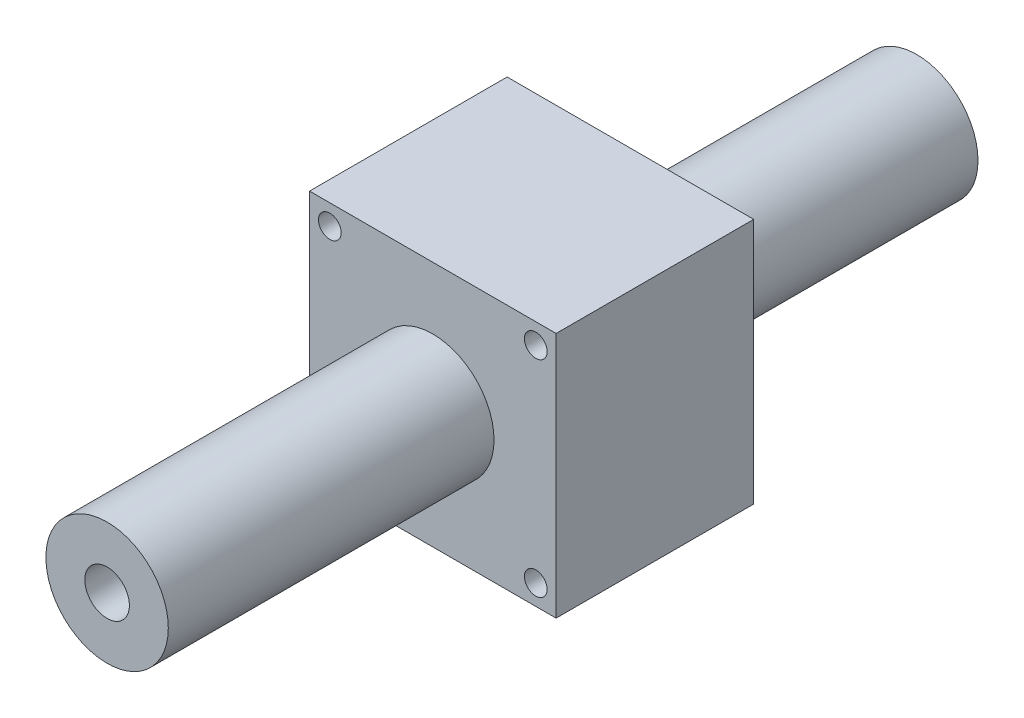
from build123d import *

# Parameters (mm, degrees)
NA23_MOTOR_ENVELOPE_START         = -45.2
SKETCH1_W                         = 56.4
SKETCH1_H                         = 56.4
SKETCH1_R                         = 2.6
NA23_MOTOR_ENVELOPE_DEPTH         = 45.2
REAR_BARREL_ENVELOPE_START        = -110.7
SKETCH2_R                         = 14
REAR_BARREL_ENVELOPE_DEPTH        = 65.5
SKETCH3_R                         = 14
SKETCH3_R_2                       = 5.1
FIXED_FRONT_BARREL_ENVELOPE_DEPTH = 74.5


with BuildPart() as part:
    # Sketch1 → NA23_Motor_Envelope (new body)
    with BuildSketch(Plane.XY.offset(NA23_MOTOR_ENVELOPE_START)):
        Rectangle(SKETCH1_W, SKETCH1_H)
        with Locations((-23.55, -23.55)):
            Circle(SKETCH1_R, mode=Mode.SUBTRACT)
        with Locations((-23.55, 23.55)):
            Circle(SKETCH1_R, mode=Mode.SUBTRACT)
        with Locations((23.55, -23.55)):
            Circle(SKETCH1_R, mode=Mode.SUBTRACT)
        with Locations((23.55, 23.55)):
            Circle(SKETCH1_R, mode=Mode.SUBTRACT)
    extrude(amount=NA23_MOTOR_ENVELOPE_DEPTH)

    # Sketch2 → Rear_Barrel_Envelope (add)
    with BuildSketch(Plane.XY.offset(REAR_BARREL_ENVELOPE_START)):
        Circle(SKETCH2_R)
    extrude(amount=REAR_BARREL_ENVELOPE_DEPTH)

    # Sketch3 → Fixed_Front_Barrel_Envelope (add)
    with BuildSketch(Plane.XY):
        Circle(SKETCH3_R)
        Circle(SKETCH3_R_2, mode=Mode.SUBTRACT)
    extrude(amount=FIXED_FRONT_BARREL_ENVELOPE_DEPTH)


solid = part.part
